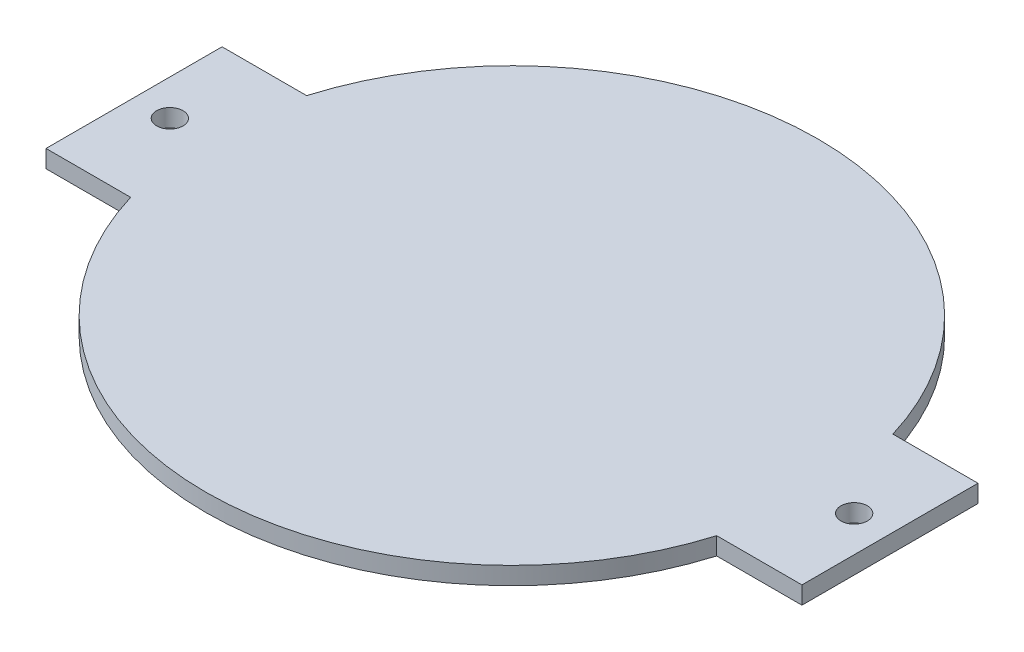
from build123d import *

# Parameters (mm, degrees)
SKETCH1_R           = 0.75
BOSS_EXTRUDE1_DEPTH = 1


with BuildPart() as part:
    # Sketch1 → Boss-Extrude1 (new body)
    with BuildSketch(Plane(origin=(0, 0, 0), x_dir=(0.9985596815585084, 0, -0.05365223542193357), z_dir=(0, 1, 0))):
        with BuildLine():
            Line((-66.808342968, 7.045429711), (-62.014590734, 6.78786321))
            ThreePointArc((-62.014590734, 6.78786321), (-44.724012488, 18.268182494), (-28.763093531, 5.001272795))
            Line((-28.763093531, 5.001272795), (-23.934184481, 4.741817331))
            Line((-23.934184481, 4.741817331), (-24.470706835, -5.243779484))
            Line((-24.470706835, -5.243779484), (-29.305653961, -4.983999597))
            ThreePointArc((-29.305653961, -4.983999597), (-46.589114014, -16.444540489), (-62.545075012, -3.198058029))
            Line((-62.545075012, -3.198058029), (-67.344865322, -2.940167104))
            Line((-67.344865322, -2.940167104), (-66.808342968, 7.045429711))
        make_face()
        with Locations(Location((-65.045034473, 1.94347583, 0), (0, 0, 266.924476629))):
            Circle(SKETCH1_R, mode=Mode.SUBTRACT)
        with Locations(Location((-26.23401533, -0.141825604, 0), (0, 0, 266.924476629))):
            Circle(SKETCH1_R, mode=Mode.SUBTRACT)
    extrude(amount=BOSS_EXTRUDE1_DEPTH)


solid = part.part
